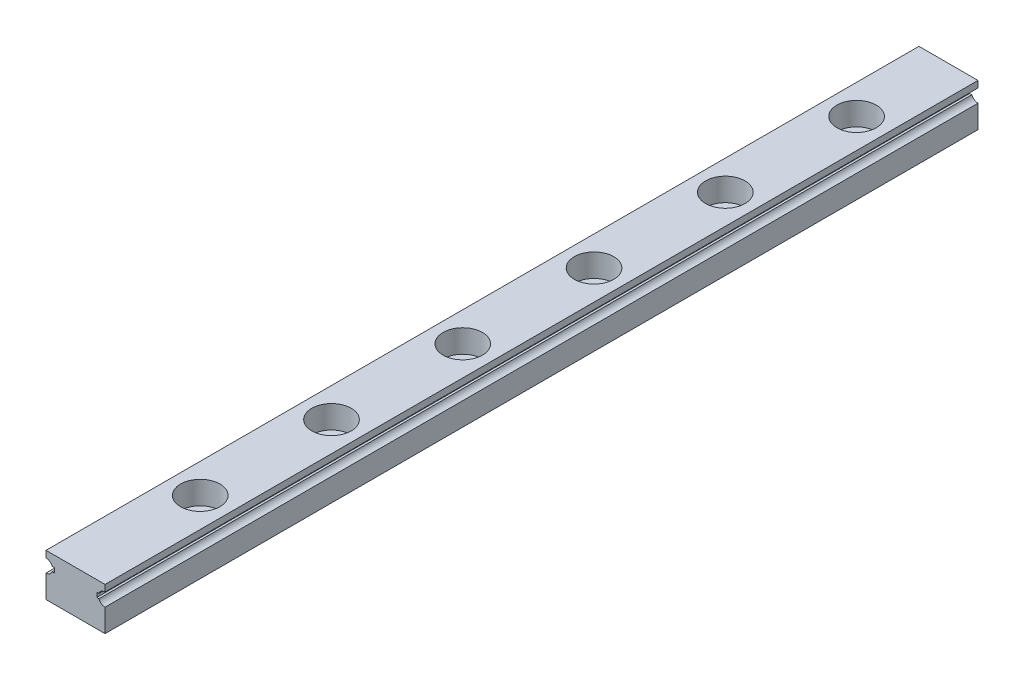
from build123d import *

# Parameters (mm, degrees)
EXTRUDE1_DEPTH  = 133
SKETCH2_R       = 3
EXTRUDE2_DEPTH  = 3.5
SKETCH_R        = 1.75
EXTRUDE3_DEPTH  = 134.234755226
LPATTERN1_COUNT = 6
LPATTERN1_PITCH = 20


with BuildPart() as part:
    # Sketch1 → Extrude1 (new body)
    with BuildSketch(Plane.XY):
        with BuildLine():
            Line((-4.5, -3.25), (4.5, -3.25))
            Line((4.5, -3.25), (4.5, 0.25))
            ThreePointArc((4.5, 0.25), (3.93077967, 0.427814974), (3.563991137, 0.898023568))
            Line((3.563991137, 0.898023568), (3.235073025, 0.898023568))
            Line((3.235073025, 0.898023568), (3.235073025, 1.601976432))
            Line((3.235073025, 1.601976432), (3.563991137, 1.601976432))
            ThreePointArc((3.563991137, 1.601976432), (3.93077967, 2.072185026), (4.5, 2.25))
            Line((4.5, 2.25), (4.5, 3.25))
            Line((4.5, 3.25), (-4.5, 3.25))
            Line((-4.5, 3.25), (-4.5, 2.25))
            ThreePointArc((-4.5, 2.25), (-3.93077967, 2.072185026), (-3.563991137, 1.601976432))
            Line((-3.563991137, 1.601976432), (-3.235073025, 1.601976432))
            Line((-3.235073025, 1.601976432), (-3.235073025, 0.898023568))
            Line((-3.235073025, 0.898023568), (-3.563991137, 0.898023568))
            ThreePointArc((-3.563991137, 0.898023568), (-3.93077967, 0.427814974), (-4.5, 0.25))
            Line((-4.5, 0.25), (-4.5, -3.25))
        make_face()
    extrude(amount=EXTRUDE1_DEPTH)

    # Sketch2 → Extrude2 (cut)
    with BuildSketch(Plane(origin=(0, 3.25, 0), x_dir=(1, 0, 0), z_dir=(0, 1, 0))):
        with Locations((0, -14)):
            Circle(SKETCH2_R)
    extrude2 = extrude(amount=-EXTRUDE2_DEPTH, mode=Mode.SUBTRACT)

    # Sketch → Extrude3 (cut, through all)
    with BuildSketch(Plane(origin=(0, 3.25, 0), x_dir=(1, 0, 0), z_dir=(0, 1, 0))):
        with Locations((0, -14)):
            Circle(SKETCH_R)
    extrude3 = extrude(amount=-EXTRUDE3_DEPTH, mode=Mode.SUBTRACT)

    # LPattern1: Extrude2, Extrude3 ×6
    with Locations(*[(0, 0, i * LPATTERN1_PITCH) for i in range(1, LPATTERN1_COUNT)]):
        add(extrude2, mode=Mode.SUBTRACT)
        add(extrude3, mode=Mode.SUBTRACT)


solid = part.part
